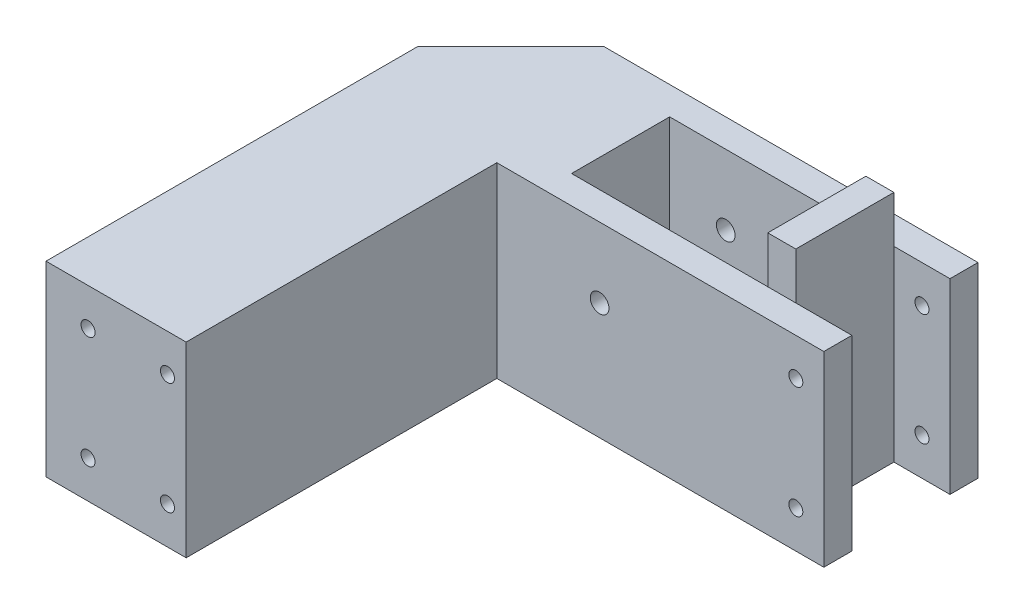
from build123d import *

# Parameters (mm, degrees)
EXTRUDE_1_DEPTH             = 40
SKETCH_8_R                  = 1.5
CUT_EXTRUDE_2_DEPTH         = 96.336247042
SKETCH_12_W                 = 30
SKETCH_12_H                 = 40
SKETCH_12_R                 = 1.5
EXTRUDE_7_DEPTH             = 66.5
EXTRUDE_7_DIRECTION_2_REACH = 97.336
CUT_EXTRUDE_3_DEPTH         = 112.45514793
CUT_EXTRUDE_START           = -50
SKETCH_15_R                 = 3.5
CUT_EXTRUDE_4_DEPTH         = 84.791815893
SKETCH_16_W                 = 6
SKETCH_16_H                 = 21
EXTRUDE_9_DEPTH             = 10
EXTRUDE_9_DIRECTION_2_REACH = 113.455
SKETCH_17_R                 = 2
CUT_EXTRUDE_5_DEPTH         = 116.422051619


with BuildPart() as part:
    # 草图1 → 凸台-拉伸1 (new body)
    with BuildSketch(Plane(origin=(0, 0, 0), x_dir=(1, 0, 0), z_dir=(0, 1, 0))):
        Polygon((0, 0), (80, 0), (80, 6), (20, 6), (20, 27), (80, 27), (80, 33), (0, 33), align=None)
    extrude(amount=EXTRUDE_1_DEPTH)

    # 草图8 → 切除-拉伸2 (cut, through all)
    with BuildSketch(Plane(origin=(0, 0, -33), x_dir=(-1, 0, 0), z_dir=(0, 0, -1))):
        with Locations((-74, 8)):
            Circle(SKETCH_8_R)
        with Locations((-74, 32)):
            Circle(SKETCH_8_R)
        with Locations((-6, 32)):
            Circle(SKETCH_8_R)
        with Locations((-6, 8)):
            Circle(SKETCH_8_R)
    extrude(amount=-CUT_EXTRUDE_2_DEPTH, mode=Mode.SUBTRACT)

    # 草图12 → 凸台-拉伸7 (add)
    with BuildSketch(Plane.XY):
        with Locations((-5, 20)):
            Rectangle(SKETCH_12_W, SKETCH_12_H)
        with Locations((-11, 32)):
            Circle(SKETCH_12_R, mode=Mode.SUBTRACT)
        with Locations((-11, 8)):
            Circle(SKETCH_12_R, mode=Mode.SUBTRACT)
        with Locations(Location((6, 8, 0), (0, 0, 180))):
            Circle(SKETCH_12_R, mode=Mode.SUBTRACT)
        with Locations(Location((6, 32, 0), (0, 0, 180))):
            Circle(SKETCH_12_R, mode=Mode.SUBTRACT)
    extrude(amount=EXTRUDE_7_DEPTH)

    # 凸台-拉伸7 direction 2: up to this face of the body (flat: up to its plane)
    extrude_7_direction_2_end = Plane(part.part.faces().sort_by_distance((40, 20, -33))[0])
    # 草图12 → 凸台-拉伸7 direction 2 (add, up to the picked face)
    with BuildSketch(Plane.XY, mode=Mode.PRIVATE) as extrude_7_direction_2_sk1:
        with Locations((-5, 20)):
            Rectangle(SKETCH_12_W, SKETCH_12_H)
        with Locations((-11, 32)):
            Circle(SKETCH_12_R, mode=Mode.SUBTRACT)
        with Locations((-11, 8)):
            Circle(SKETCH_12_R, mode=Mode.SUBTRACT)
        with Locations(Location((6, 8, 0), (0, 0, 180))):
            Circle(SKETCH_12_R, mode=Mode.SUBTRACT)
        with Locations(Location((6, 32, 0), (0, 0, 180))):
            Circle(SKETCH_12_R, mode=Mode.SUBTRACT)
    extrude_7_direction_2_tool1 = split(extrude(extrude_7_direction_2_sk1.sketch, amount=-EXTRUDE_7_DIRECTION_2_REACH, mode=Mode.PRIVATE), bisect_by=extrude_7_direction_2_end, keep=Keep.BOTH, mode=Mode.PRIVATE)
    add(extrude_7_direction_2_tool1.solids().sort_by(Axis((-5.060326, 20, 0), (0, 0, -1)))[0])

    # 草图14 → 切除-拉伸3 (cut, through all)
    with BuildSketch(Plane(origin=(0, 40, 0), x_dir=(1, 0, 0), z_dir=(0, 1, 0))):
        Polygon((-20, 33), (0, 33), (-20, 13), align=None)
    extrude(amount=-CUT_EXTRUDE_3_DEPTH, mode=Mode.SUBTRACT)

    # 草图15 → 切除-拉伸4 (cut, through all)
    with BuildSketch(Plane.XY.offset(66.5).offset(CUT_EXTRUDE_START)):
        with Locations((-11, 32)):
            Circle(SKETCH_15_R)
        with Locations((-11, 8)):
            Circle(SKETCH_15_R)
    extrude(amount=-CUT_EXTRUDE_4_DEPTH, mode=Mode.SUBTRACT)

    # 草图16 → 凸台-拉伸9 (add)
    with BuildSketch(Plane(origin=(0, 40, 0), x_dir=(1, 0, 0), z_dir=(0, 1, 0))):
        with Locations((65, 16.5)):
            Rectangle(SKETCH_16_W, SKETCH_16_H)
    extrude(amount=EXTRUDE_9_DEPTH)

    # 凸台-拉伸9 direction 2: up to this face of the body (flat: up to its plane)
    extrude_9_direction_2_end = Plane(part.part.faces().sort_by_distance((7.48152977, 0, 9.893198609))[0])
    # 草图16 → 凸台-拉伸9 direction 2 (add, up to the picked face)
    with BuildSketch(Plane(origin=(0, 40, 0), x_dir=(1, 0, 0), z_dir=(0, 1, 0)), mode=Mode.PRIVATE) as extrude_9_direction_2_sk1:
        with Locations((65, 16.5)):
            Rectangle(SKETCH_16_W, SKETCH_16_H)
    extrude_9_direction_2_tool1 = split(extrude(extrude_9_direction_2_sk1.sketch, amount=-EXTRUDE_9_DIRECTION_2_REACH, mode=Mode.PRIVATE), bisect_by=extrude_9_direction_2_end, keep=Keep.BOTH, mode=Mode.PRIVATE)
    add(extrude_9_direction_2_tool1.solids().sort_by(Axis((65, 40, -16.5), (0, -1, 0)))[0])

    # 草图17 → 切除-拉伸5 (cut, through all)
    with BuildSketch(Plane.XY):
        with Locations((32, 25)):
            Circle(SKETCH_17_R)
    extrude(amount=-CUT_EXTRUDE_5_DEPTH, mode=Mode.SUBTRACT)


solid = part.part
